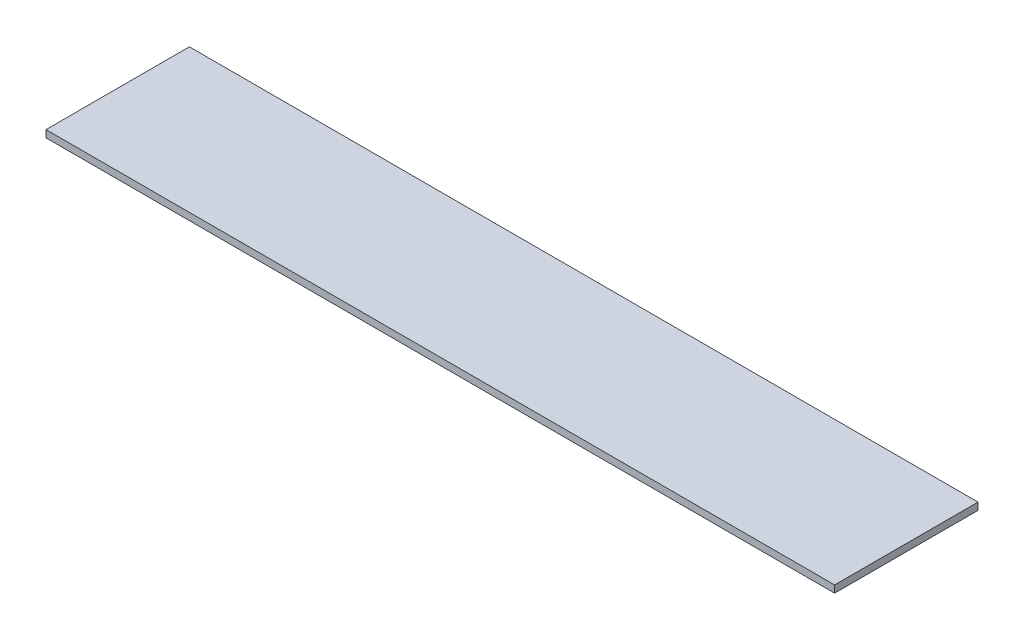
from build123d import *

# Parameters (mm, degrees)
SKETCH1_W           = 110
SKETCH1_H           = 20
BOSS_EXTRUDE1_DEPTH = 1


with BuildPart() as part:
    # Sketch1 → Boss-Extrude1 (new body)
    with BuildSketch(Plane(origin=(0, 0, 0), x_dir=(1, 0, 0), z_dir=(0, 1, 0))):
        with Locations((55, 10)):
            Rectangle(SKETCH1_W, SKETCH1_H)
    extrude(amount=BOSS_EXTRUDE1_DEPTH)


solid = part.part
